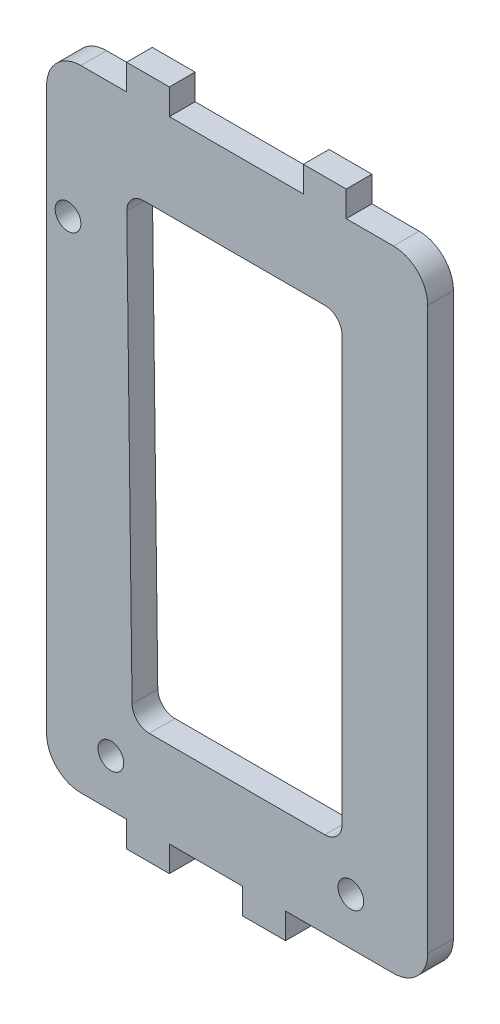
from build123d import *

# Parameters (mm, degrees)
CROQUIS1_R              = 1.5
SALIENTE_EXTRUIR1_DEPTH = 3


with BuildPart() as part:
    # Croquis1 → Saliente-Extruir1 (new body)
    with BuildSketch(Plane.XY):
        with BuildLine():
            Line((-27.735211809, 52.645866632), (-43.365211809, 52.645866632))
            Line((-43.365211809, 52.645866632), (-43.365211809, 55.645866632))
            Line((-43.365211809, 55.645866632), (-48.365211809, 55.645866632))
            Line((-48.365211809, 55.645866632), (-48.365211809, 52.645866632))
            Line((-48.365211809, 52.645866632), (-53.695211809, 52.645866632))
            ThreePointArc((-53.695211809, 52.645866632), (-56.523638933, 51.474293757), (-57.695211809, 48.645866632))
            Line((-57.695211809, 48.645866632), (-57.695211809, -16.854133368))
            ThreePointArc((-57.695211809, -16.854133368), (-56.523638933, -19.682560493), (-53.695211809, -20.854133368))
            Line((-53.695211809, -20.854133368), (-48.365211809, -20.854133368))
            Line((-48.365211809, -20.854133368), (-48.365211809, -23.854133368))
            Line((-48.365211809, -23.854133368), (-43.365211809, -23.854133368))
            Line((-43.365211809, -23.854133368), (-43.365211809, -20.854133368))
            Line((-43.365211809, -20.854133368), (-34.815211809, -20.854133368))
            Line((-34.815211809, -20.854133368), (-34.815211809, -23.854133368))
            Line((-34.815211809, -23.854133368), (-29.815211809, -23.854133368))
            Line((-29.815211809, -23.854133368), (-29.815211809, -20.854133368))
            Line((-29.815211809, -20.854133368), (-17.225211809, -20.854133368))
            ThreePointArc((-17.225211809, -20.854133368), (-14.396784684, -19.682560493), (-13.225211809, -16.854133368))
            Line((-13.225211809, -16.854133368), (-13.225211809, 48.645866632))
            ThreePointArc((-13.225211809, 48.645866632), (-14.396784684, 51.474293757), (-17.225211809, 52.645866632))
            Line((-17.225211809, 52.645866632), (-22.735211809, 52.645866632))
            Line((-22.735211809, 52.645866632), (-22.735211809, 55.645866632))
            Line((-22.735211809, 55.645866632), (-27.735211809, 55.645866632))
            Line((-27.735211809, 55.645866632), (-27.735211809, 52.645866632))
        make_face()
        with Locations((-55.195211809, 36.645866632)):
            Circle(CROQUIS1_R, mode=Mode.SUBTRACT)
        with Locations((-50.195211809, -15.354133368)):
            Circle(CROQUIS1_R, mode=Mode.SUBTRACT)
        with Locations((-22.195211809, -15.354133368)):
            Circle(CROQUIS1_R, mode=Mode.SUBTRACT)
        with BuildLine():
            Line((-35.550211809, 42.645866632), (-25.225211809, 42.645866632))
            ThreePointArc((-25.225211809, 42.645866632), (-23.810998246, 42.060080194), (-23.225211809, 40.645866632))
            Line((-23.225211809, 40.645866632), (-23.225211809, -8.854133368))
            ThreePointArc((-23.225211809, -8.854133368), (-23.810998246, -10.26834693), (-25.225211809, -10.854133368))
            Line((-25.225211809, -10.854133368), (-45.720101709, -10.854133368))
            ThreePointArc((-45.720101709, -10.854133368), (-47.125432715, -10.277174044), (-47.719944893, -8.879178133))
            Line((-47.719944893, -8.879178133), (-48.339851435, 40.620821867))
            ThreePointArc((-48.339851435, 40.620821867), (-47.763048927, 42.051197638), (-46.340008251, 42.645866632))
            Line((-46.340008251, 42.645866632), (-35.550211809, 42.645866632))
        make_face(mode=Mode.SUBTRACT)
    extrude(amount=SALIENTE_EXTRUIR1_DEPTH)


solid = part.part
